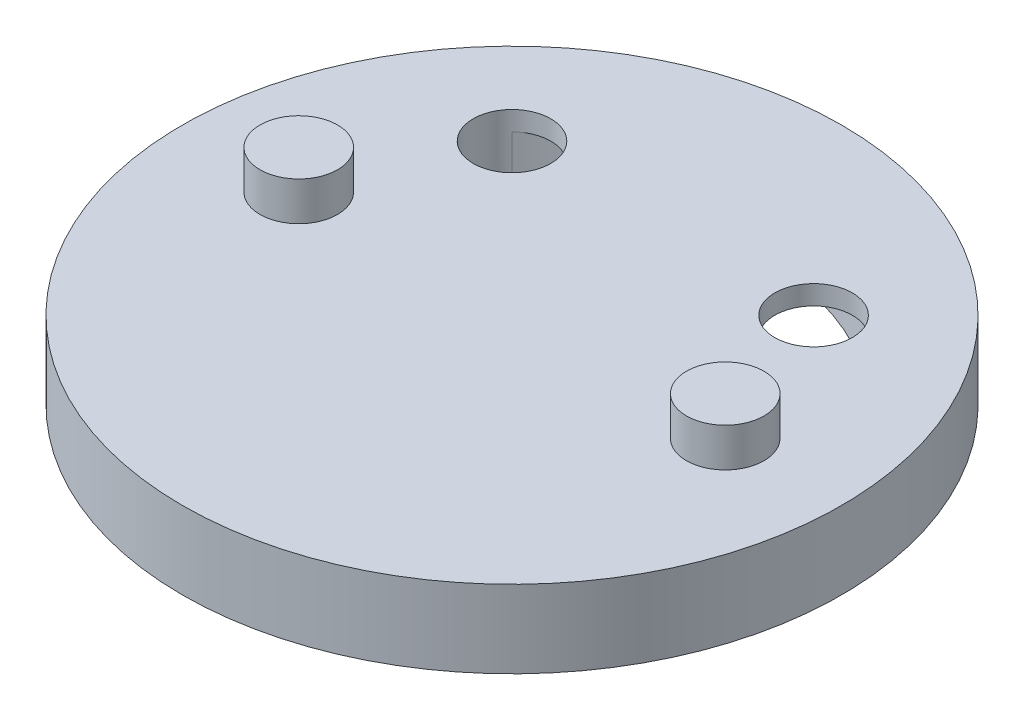
from build123d import *

# Parameters (mm, degrees)
SKETCH_1_R          = 17
EXTRUDE_1_DEPTH     = 4
SKETCH_2_R          = 2
CUT_EXTRUDE_1_DEPTH = 3
SKETCH_2_3_R        = 2
EXTRUDE_2_DEPTH     = 2
CUT_EXTRUDE_START   = -3
CUT_EXTRUDE_2_DEPTH = 3


with BuildPart() as part:
    # 草图1 → 凸台-拉伸1 (new body)
    with BuildSketch(Plane(origin=(0, 0, 0), x_dir=(1, 0, 0), z_dir=(0, 1, 0))):
        Circle(SKETCH_1_R)
    extrude(amount=EXTRUDE_1_DEPTH)

    # 草图2 → 切除-拉伸1 (cut)
    with BuildSketch(Plane(origin=(0, 4, 0), x_dir=(1, 0, 0), z_dir=(0, 1, 0))):
        with Locations((-7.778174593, 7.778174593)):
            Circle(SKETCH_2_R)
        with Locations((7.778174593, 7.778174593)):
            Circle(SKETCH_2_R)
    extrude(amount=-CUT_EXTRUDE_1_DEPTH, mode=Mode.SUBTRACT)

    # 草图2<3> → 凸台-拉伸2 (add)
    with BuildSketch(Plane(origin=(0, 4, 0), x_dir=(1, 0, 0), z_dir=(0, 1, 0))):
        with Locations((-11, 0)):
            Circle(SKETCH_2_3_R)
        with Locations((11, 0)):
            Circle(SKETCH_2_3_R)
    extrude(amount=EXTRUDE_2_DEPTH)

    # 草图4 → 切除-拉伸2 (cut)
    with BuildSketch(Plane.XZ.offset(CUT_EXTRUDE_START)):
        with BuildLine():
            ThreePointArc((-9.192388155, -9.192388155), (0, -13), (9.192388155, -9.192388155))
            ThreePointArc((9.192388155, -9.192388155), (9.192388155, -6.363961031), (6.363961031, -6.363961031))
            ThreePointArc((6.363961031, -6.363961031), (0, -9), (-6.363961031, -6.363961031))
            ThreePointArc((-6.363961031, -6.363961031), (-9.192388155, -6.363961031), (-9.192388155, -9.192388155))
        make_face()
        with BuildLine():
            ThreePointArc((-9.192388155, 9.192388155), (0, 13), (9.192388155, 9.192388155))
            ThreePointArc((9.192388155, 9.192388155), (9.192388155, 6.363961031), (6.363961031, 6.363961031))
            ThreePointArc((6.363961031, 6.363961031), (0, 9), (-6.363961031, 6.363961031))
            ThreePointArc((-6.363961031, 6.363961031), (-9.192388155, 6.363961031), (-9.192388155, 9.192388155))
        make_face()
    extrude(amount=CUT_EXTRUDE_2_DEPTH, mode=Mode.SUBTRACT)


solid = part.part
